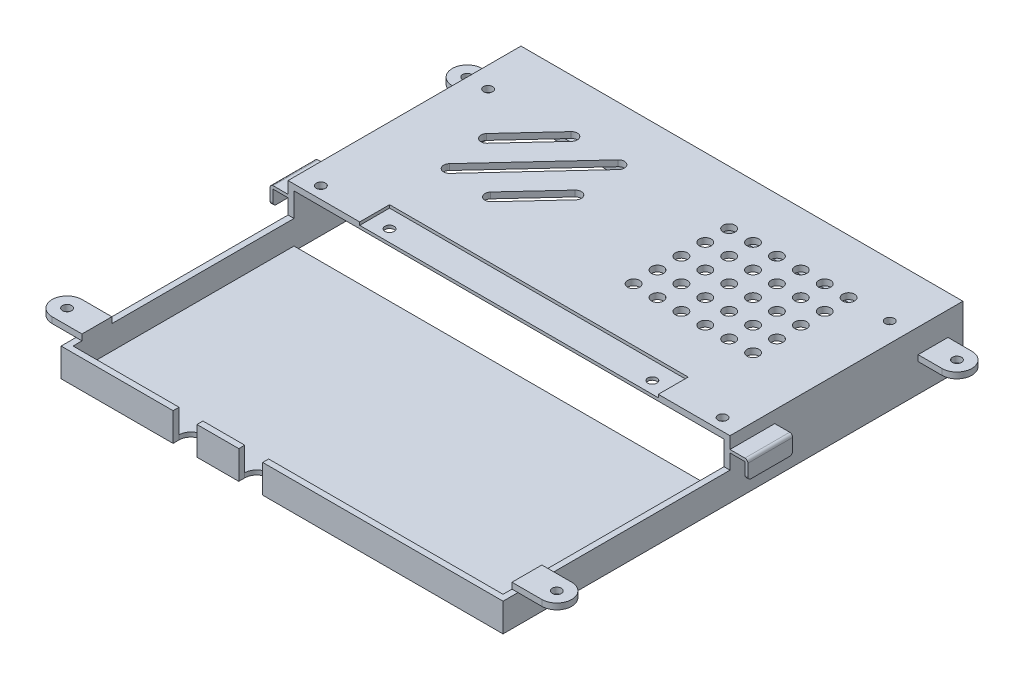
from build123d import *

# Parameters (mm, degrees)
EXTRUDE_1_DEPTH      = 148
SKETCH_2_W           = 144
SKETCH_2_H           = 74
CUT_EXTRUDE_1_DEPTH  = 8
SKETCH_3_W           = 144
SKETCH_3_H           = 76
CUT_EXTRUDE_2_DEPTH  = 17.5
SKETCH_6_R           = 1.525
EXTRUDE_2_DEPTH      = 2
SKETCH_7_R           = 1.525
CUT_EXTRUDE_3_DEPTH  = 2
SKETCH_8_W           = 100
SKETCH_8_H           = 10
CUT_EXTRUDE_4_DEPTH  = 1
SKETCH_10_R          = 1.5
SKETCH_10_R_2        = 2
CUT_EXTRUDE_6_DEPTH  = 2
SKETCH_12_W          = 43
SKETCH_12_H          = 5
SKETCH_12_W_2        = 25
SKETCH_12_H_2        = 6
CUT_EXTRUDE_7_DEPTH  = 2
SKETCH_14_R          = 1.525
CUT_EXTRUDE_8_DEPTH  = 2
SKETCH_15_W          = 8
SKETCH_15_H          = 8
CUT_EXTRUDE_9_DEPTH  = 10
CUT_EXTRUDE_11_DEPTH = 10
EXTRUDE_START        = 48
EXTRUDE_3_DEPTH      = 15
FILLET_1_R           = 1
FILLET_2_R           = 1


with BuildPart() as part:
    # 草图1 → 凸台-拉伸1 (new body)
    with BuildSketch(Plane(origin=(0, 0, 0), x_dir=(0, 0, -1), z_dir=(1, 0, 0))):
        Polygon((0, 0), (154, 0), (154, 19.5), (76, 19.5), (76, 9.5), (0, 9.5), align=None)
    extrude(amount=EXTRUDE_1_DEPTH)

    # 草图2 → 切除-拉伸1 (cut)
    with BuildSketch(Plane(origin=(0, 9.5, 0), x_dir=(1, 0, 0), z_dir=(0, 1, 0))):
        with Locations((74, 39)):
            Rectangle(SKETCH_2_W, SKETCH_2_H)
    extrude(amount=-CUT_EXTRUDE_1_DEPTH, mode=Mode.SUBTRACT)

    # 草图3 → 切除-拉伸2 (cut)
    with BuildSketch(Plane.XZ):
        with Locations((74, -114)):
            Rectangle(SKETCH_3_W, SKETCH_3_H)
    extrude(amount=-CUT_EXTRUDE_2_DEPTH, mode=Mode.SUBTRACT)

    # 草图6 → 凸台-拉伸2 (add)
    # profile 1 of 4: a face of its own
    with BuildSketch(Plane(origin=(0, 9.5, 0), x_dir=(1, 0, 0), z_dir=(0, 1, 0))):
        with BuildLine():
            Line((146, 5), (156, 5))
            ThreePointArc((156, 5), (161, 10), (156, 15))
            Line((156, 15), (146, 15))
            Line((146, 15), (146, 5))
        make_face()
        with Locations(Location((156, 10, 0), (0, 0, 270))):
            Circle(SKETCH_6_R, mode=Mode.SUBTRACT)
    # profile 2 of 4: a face of its own
    with BuildSketch(Plane(origin=(0, 9.5, 0), x_dir=(1, 0, 0), z_dir=(0, 1, 0))):
        with BuildLine():
            Line((-8, 15), (2, 15))
            Line((2, 15), (2, 5))
            Line((2, 5), (-8, 5))
            ThreePointArc((-8, 5), (-13, 10), (-8, 15))
        make_face()
        with Locations(Location((-8, 10, 0), (0, 0, 90))):
            Circle(SKETCH_6_R, mode=Mode.SUBTRACT)
    # profile 3 of 4: a face of its own
    with BuildSketch(Plane(origin=(0, 9.5, 0), x_dir=(1, 0, 0), z_dir=(0, 1, 0))):
        with BuildLine():
            Line((146, 139), (156, 139))
            ThreePointArc((156, 139), (161, 144), (156, 149))
            Line((156, 149), (146, 149))
            Line((146, 149), (146, 139))
        make_face()
        with Locations(Location((156, 144, 0), (0, 0, 270))):
            Circle(SKETCH_6_R, mode=Mode.SUBTRACT)
    # profile 4 of 4: a face of its own
    with BuildSketch(Plane(origin=(0, 9.5, 0), x_dir=(1, 0, 0), z_dir=(0, 1, 0))):
        with BuildLine():
            Line((-8, 149), (2, 149))
            Line((2, 149), (2, 139))
            Line((2, 139), (-8, 139))
            ThreePointArc((-8, 139), (-13, 144), (-8, 149))
        make_face()
        with Locations(Location((-8, 144, 0), (0, 0, 90))):
            Circle(SKETCH_6_R, mode=Mode.SUBTRACT)
    extrude(amount=EXTRUDE_2_DEPTH)

    # 草图7 → 切除-拉伸3 (cut)
    with BuildSketch(Plane(origin=(0, 19.5, 0), x_dir=(1, 0, 0), z_dir=(0, 1, 0))):
        with Locations(Location((118, 80, 0), (0, 0, 270))):
            Circle(SKETCH_7_R)
        with Locations(Location((30, 80, 0), (0, 0, 270))):
            Circle(SKETCH_7_R)
    extrude(amount=-CUT_EXTRUDE_3_DEPTH, mode=Mode.SUBTRACT)

    # 草图8 → 切除-拉伸4 (cut)
    with BuildSketch(Plane(origin=(0, 19.5, 0), x_dir=(1, 0, 0), z_dir=(0, 1, 0))):
        with Locations((74, 81)):
            Rectangle(SKETCH_8_W, SKETCH_8_H)
    extrude(amount=-CUT_EXTRUDE_4_DEPTH, mode=Mode.SUBTRACT)

    # 草图10 → 切除-拉伸6 (cut)
    with BuildSketch(Plane(origin=(0, 19.5, 0), x_dir=(1, 0, 0), z_dir=(0, 1, 0))):
        with Locations((92.824957671, 0)):
            Circle(SKETCH_10_R)
        with Locations(Location((87.811120796, 135.911745597, 0), (0, 0, 270))):
            Circle(SKETCH_10_R_2)
        with Locations(Location((95.811120796, 135.911745597, 0), (0, 0, 270))):
            Circle(SKETCH_10_R_2)
        with Locations(Location((103.811120796, 135.911745597, 0), (0, 0, 270))):
            Circle(SKETCH_10_R_2)
        with Locations(Location((111.811120796, 135.911745597, 0), (0, 0, 270))):
            Circle(SKETCH_10_R_2)
        with Locations(Location((119.811120796, 135.911745597, 0), (0, 0, 270))):
            Circle(SKETCH_10_R_2)
        with Locations(Location((127.811120796, 135.911745597, 0), (0, 0, 270))):
            Circle(SKETCH_10_R_2)
        with Locations(Location((95.811120796, 127.911745597, 0), (0, 0, 270))):
            Circle(SKETCH_10_R_2)
        with Locations(Location((103.811120796, 127.911745597, 0), (0, 0, 270))):
            Circle(SKETCH_10_R_2)
        with Locations(Location((111.811120796, 127.911745597, 0), (0, 0, 270))):
            Circle(SKETCH_10_R_2)
        with Locations(Location((119.811120796, 127.911745597, 0), (0, 0, 270))):
            Circle(SKETCH_10_R_2)
        with Locations(Location((127.811120796, 127.911745597, 0), (0, 0, 270))):
            Circle(SKETCH_10_R_2)
        with Locations(Location((95.811120796, 119.911745597, 0), (0, 0, 270))):
            Circle(SKETCH_10_R_2)
        with Locations(Location((103.811120796, 119.911745597, 0), (0, 0, 270))):
            Circle(SKETCH_10_R_2)
        with Locations(Location((111.811120796, 119.911745597, 0), (0, 0, 270))):
            Circle(SKETCH_10_R_2)
        with Locations(Location((119.811120796, 119.911745597, 0), (0, 0, 270))):
            Circle(SKETCH_10_R_2)
        with Locations(Location((127.811120796, 119.911745597, 0), (0, 0, 270))):
            Circle(SKETCH_10_R_2)
        with Locations(Location((95.811120796, 111.911745597, 0), (0, 0, 270))):
            Circle(SKETCH_10_R_2)
        with Locations(Location((103.811120796, 111.911745597, 0), (0, 0, 270))):
            Circle(SKETCH_10_R_2)
        with Locations(Location((111.811120796, 111.911745597, 0), (0, 0, 270))):
            Circle(SKETCH_10_R_2)
        with Locations(Location((119.811120796, 111.911745597, 0), (0, 0, 270))):
            Circle(SKETCH_10_R_2)
        with Locations(Location((127.811120796, 111.911745597, 0), (0, 0, 270))):
            Circle(SKETCH_10_R_2)
        with Locations(Location((95.811120796, 103.911745597, 0), (0, 0, 270))):
            Circle(SKETCH_10_R_2)
        with Locations(Location((103.811120796, 103.911745597, 0), (0, 0, 270))):
            Circle(SKETCH_10_R_2)
        with Locations(Location((111.811120796, 103.911745597, 0), (0, 0, 270))):
            Circle(SKETCH_10_R_2)
        with Locations(Location((119.811120796, 103.911745597, 0), (0, 0, 270))):
            Circle(SKETCH_10_R_2)
        with Locations(Location((127.811120796, 103.911745597, 0), (0, 0, 270))):
            Circle(SKETCH_10_R_2)
        with Locations(Location((87.811120796, 127.911745597, 0), (0, 0, 270))):
            Circle(SKETCH_10_R_2)
        with Locations(Location((87.811120796, 119.911745597, 0), (0, 0, 270))):
            Circle(SKETCH_10_R_2)
        with Locations(Location((87.811120796, 111.911745597, 0), (0, 0, 270))):
            Circle(SKETCH_10_R_2)
        with Locations(Location((87.811120796, 103.911745597, 0), (0, 0, 270))):
            Circle(SKETCH_10_R_2)
        with BuildLine():
            Line((36.136845643, 134.865517695), (22.562000425, 120.17798634))
            ThreePointArc((22.562000425, 120.17798634), (19.735762768, 120.066717726), (19.624494154, 122.892955383))
            Line((19.624494154, 122.892955383), (33.199339372, 137.580486739))
            ThreePointArc((33.199339372, 137.580486739), (36.025577029, 137.691755353), (36.136845643, 134.865517695))
        make_face()
        with BuildLine():
            Line((52.189559598, 134.554261075), (25.039869163, 105.179198365))
            ThreePointArc((25.039869163, 105.179198365), (22.213631506, 105.067929751), (22.102362892, 107.894167408))
            Line((22.102362892, 107.894167408), (49.252053327, 137.269230119))
            ThreePointArc((49.252053327, 137.269230119), (52.078290985, 137.380498733), (52.189559598, 134.554261075))
        make_face()
        with BuildLine():
            Line((50.824376998, 121.290672478), (37.249531781, 106.603141122))
            ThreePointArc((37.249531781, 106.603141122), (37.360800394, 103.776903465), (40.187038052, 103.888172079))
            Line((40.187038052, 103.888172079), (53.761883269, 118.575703434))
            ThreePointArc((53.761883269, 118.575703434), (53.650614655, 121.401941091), (50.824376998, 121.290672478))
        make_face()
    extrude(amount=-CUT_EXTRUDE_6_DEPTH, mode=Mode.SUBTRACT)

    # 草图12 → 切除-拉伸7 (cut)
    with BuildSketch(Plane(origin=(0, 0, -154), x_dir=(-1, 0, 0), z_dir=(0, 0, -1))):
        with Locations((-97, 4.5)):
            Rectangle(SKETCH_12_W, SKETCH_12_H)
        with Locations((-18, 5)):
            Rectangle(SKETCH_12_W_2, SKETCH_12_H_2)
    extrude(amount=-CUT_EXTRUDE_7_DEPTH, mode=Mode.SUBTRACT)

    # 草图14 → 切除-拉伸8 (cut)
    with BuildSketch(Plane.XZ.offset(-17.5)):
        with Locations(Location((141.5, -80, 0), (0, 0, 270))):
            Circle(SKETCH_14_R)
        with Locations(Location((141.5, -136, 0), (0, 0, 270))):
            Circle(SKETCH_14_R)
        with Locations(Location((7, -136, 0), (0, 0, 270))):
            Circle(SKETCH_14_R)
        with Locations(Location((7, -80, 0), (0, 0, 270))):
            Circle(SKETCH_14_R)
    extrude(amount=-CUT_EXTRUDE_8_DEPTH, mode=Mode.SUBTRACT)

    # 草图15 → 切除-拉伸9 (cut)
    with BuildSketch(Plane(origin=(0, 0, -2), x_dir=(-1, 0, 0), z_dir=(0, 0, -1))):
        with Locations((-41.5, 5.5)):
            Rectangle(SKETCH_15_W, SKETCH_15_H)
        with Locations((-63.5, 5.5)):
            Rectangle(SKETCH_15_W, SKETCH_15_H)
    extrude(amount=-CUT_EXTRUDE_9_DEPTH, mode=Mode.SUBTRACT)

    # 草图16 → 切除-拉伸11 (cut)
    with BuildSketch(Plane(origin=(0, 1.5, 0), x_dir=(1, 0, 0), z_dir=(0, 1, 0))):
        with BuildLine():
            Line((45.5, 2), (45.5, 0))
            Line((45.5, 0), (37.5, 0))
            Line((37.5, 0), (37.5, 2))
            ThreePointArc((37.5, 2), (41.5, 6), (45.5, 2))
        make_face()
        with BuildLine():
            Line((67.5, 2), (67.5, 0))
            Line((67.5, 0), (59.5, 0))
            Line((59.5, 0), (59.5, 2))
            ThreePointArc((59.5, 2), (63.5, 6), (67.5, 2))
        make_face()
    extrude(amount=-CUT_EXTRUDE_11_DEPTH, mode=Mode.SUBTRACT)

    # 草图17 → 凸台-拉伸3 (add)
    with BuildSketch(Plane.XY.offset(-139).offset(EXTRUDE_START)):
        Polygon((148, 14.5), (148, 15.5), (154, 15.5), (154, 9.5), (153, 9.5), (153, 14.5), align=None)
        Polygon((0, 15.5), (-6, 15.5), (-6, 9.5), (-5, 9.5), (-5, 14.5), (0, 14.5), align=None)
    extrude(amount=EXTRUDE_3_DEPTH)

    # 圆角1
    fillet_1_edges = [part.edges().sort_by_distance(p)[0] for p in [
        (-6, 15.5, -83.5),
        (154, 15.5, -83.5),
    ]]
    fillet(fillet_1_edges, radius=FILLET_1_R)

    # 圆角2
    fillet_2_edges = [part.edges().sort_by_distance(p)[0] for p in [
        (-5.5, 9.5, -91),
        (-5.5, 9.5, -76),
        (153.5, 9.5, -91),
        (153.5, 9.5, -76),
    ]]
    fillet(fillet_2_edges, radius=FILLET_2_R)


solid = part.part
